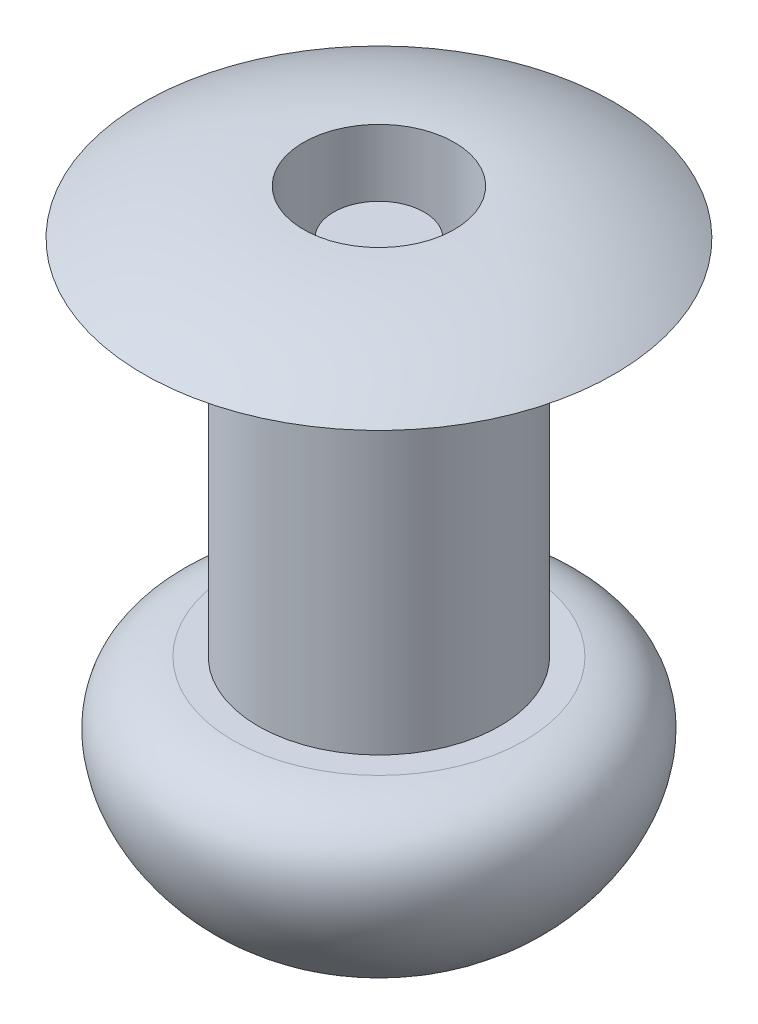
from build123d import *


with BuildPart() as part:
    # Szkic1 → Obrót1 (revolve)
    with BuildSketch(Plane(origin=(0, 0, 0), x_dir=(0, 0, -1), z_dir=(1, 0, 0)), mode=Mode.PRIVATE) as obr_t1_sk:
        with BuildLine():
            Line((0, 0), (0, -6))
            Line((0, -6), (0, -7.5))
            add(Edge.make_bspline(
                [(-0.956030427, -7.378190671), (-0.520263876, -7.5), (0, -7.5)],
                knots=[0.992852221, 0.992852221, 0.992852221, 1.570796327, 1.570796327, 1.570796327], degree=2, weights=[1, 0.958537313, 1]))
            add(Edge.make_bspline(
                [(-2.413891755, -6), (-3.858559437, -6.163296686), (-3.558358928, -8.322980362), (-0.971318098, -9.871940016), (-0.341145137, -7.79203191), (-0.956030427, -7.378190671)],
                knots=[0, 0, 0, 0, 0.454219308, 0.705200672, 1, 1, 1, 1], degree=3))
            Line((-2.413891755, -6), (-2, -6))
            Line((-2, -6), (-2, 0))
            Line((-2, 0), (-3.9, 0))
            ThreePointArc((-3.9, 0), (-2.627043935, 0.558888572), (-1.25, 0.75))
            Line((-1.25, 0.75), (-1.25, -6))
            Line((-1.25, -6), (-0.75, -6))
            Line((-0.75, -6), (-0.75, 0))
            Line((-0.75, 0), (0, 0))
        make_face()
    revolve(obr_t1_sk.sketch.rotate(Axis((0, 0, 0), (0, 1, 0)), 180), axis=Axis((0, 0, 0), (0, 1, 0)))


solid = part.part
